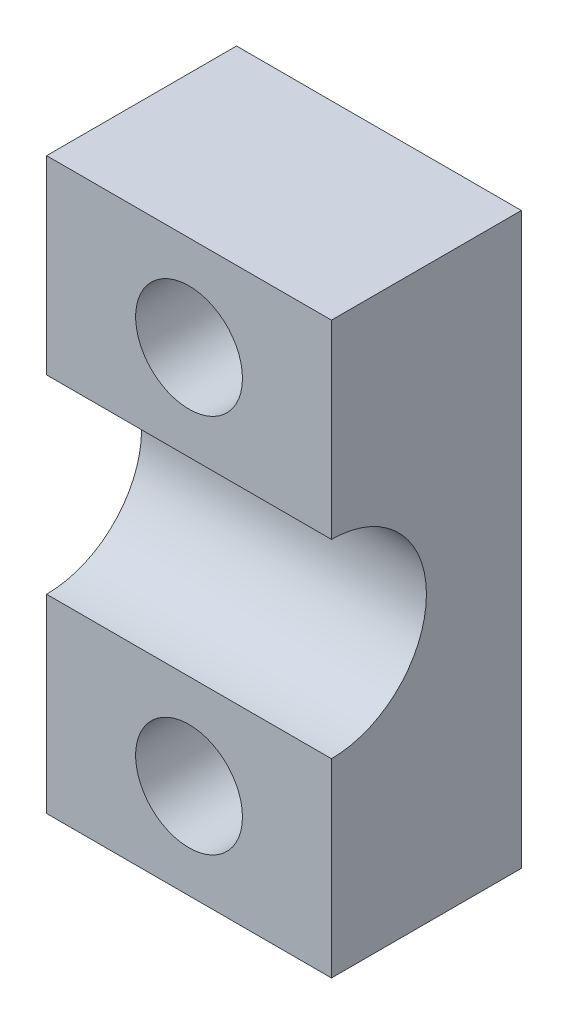
from build123d import *

# Parameters (mm, degrees)
BOSS_EXTRUDE1_DEPTH = 6
SKETCH2_R           = 2.25
CUT_EXTRUDE1_DEPTH  = 16.620499352


with BuildPart() as part:
    # Sketch1 → Boss-Extrude1 (new, symmetric)
    with BuildSketch(Plane(origin=(0, 0, 0), x_dir=(0, 0, -1), z_dir=(1, 0, 0))):
        with BuildLine():
            Line((0, 4), (0, 12))
            Line((0, 12), (8, 12))
            Line((8, 12), (8, -12))
            Line((8, -12), (0, -12))
            Line((0, -12), (0, -4))
            ThreePointArc((0, -4), (4, 0), (0, 4))
        make_face()
    extrude(amount=BOSS_EXTRUDE1_DEPTH, both=True)

    # Sketch2 → Cut-Extrude1 (cut, through all)
    with BuildSketch(Plane.XY):
        with Locations((0, 8)):
            Circle(SKETCH2_R)
        with Locations((0, -8)):
            Circle(SKETCH2_R)
    extrude(amount=-CUT_EXTRUDE1_DEPTH, mode=Mode.SUBTRACT)


solid = part.part
